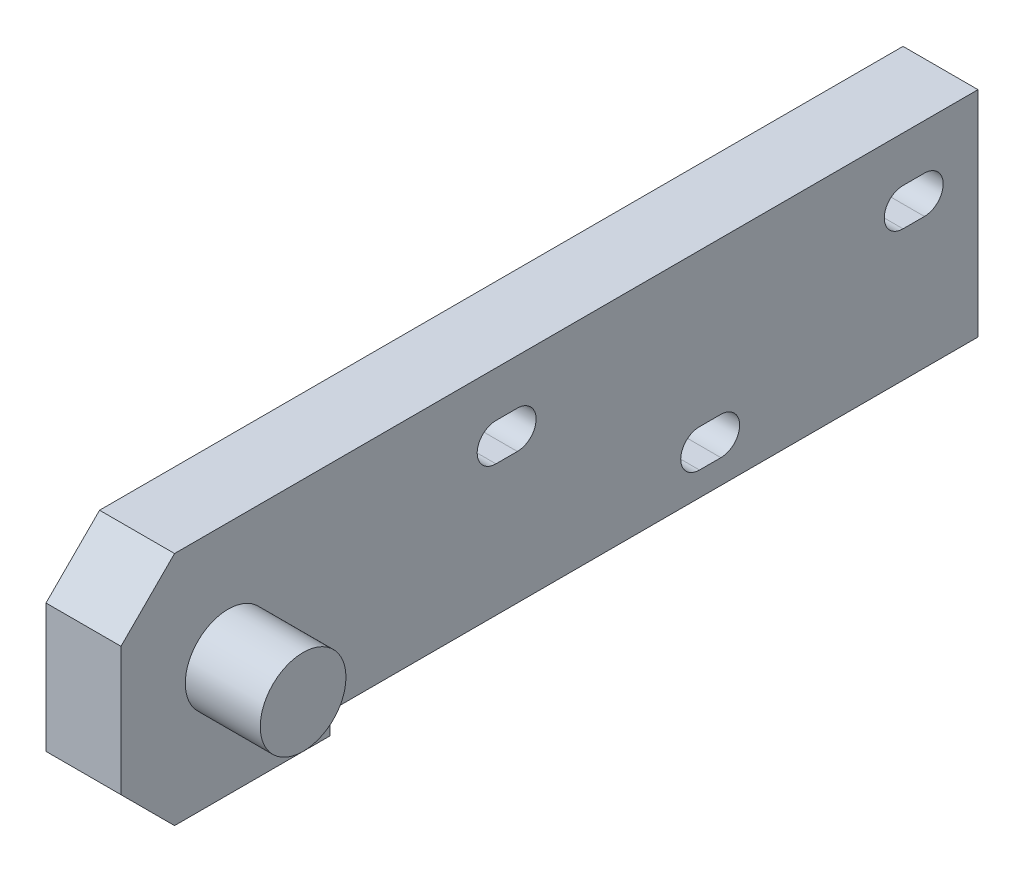
from build123d import *

# Parameters (mm, degrees)
SKETCH1_R           = 4
BOSS_EXTRUDE1_DEPTH = 7
BOSS_EXTRUDE2_START = 7
SKETCH1_4_R         = 4
BOSS_EXTRUDE2_DEPTH = 7


with BuildPart() as part:
    # Sketch1 → Boss-Extrude1 (new body)
    # profile 1 of 2: a face of its own
    with BuildSketch(Plane(origin=(0, 0, 0), x_dir=(0, 0, -1), z_dir=(1, 0, 0))):
        Polygon((-10, 6), (-10, -6), (-5, -11), (9.5, -11), (9.5, -9), (70, -9), (70, 11), (-5, 11), align=None)
        Circle(SKETCH1_R, mode=Mode.SUBTRACT)
        with BuildLine():
            ThreePointArc((63, 6.75), (61.25, 5), (63, 3.25))
            Line((63, 3.25), (65, 3.25))
            ThreePointArc((65, 3.25), (66.75, 5), (65, 6.75))
            Line((65, 6.75), (63, 6.75))
        make_face(mode=Mode.SUBTRACT)
        with BuildLine():
            ThreePointArc((46, -6.75), (47.75, -5), (46, -3.25))
            Line((46, -3.25), (44, -3.25))
            ThreePointArc((44, -3.25), (42.25, -5), (44, -6.75))
            Line((44, -6.75), (46, -6.75))
        make_face(mode=Mode.SUBTRACT)
        with BuildLine():
            ThreePointArc((27, 3.25), (28.75, 5), (27, 6.75))
            Line((27, 6.75), (25, 6.75))
            ThreePointArc((25, 6.75), (23.25, 5), (25, 3.25))
            Line((25, 3.25), (27, 3.25))
        make_face(mode=Mode.SUBTRACT)
    # profile 2 of 2: a face of its own
    with BuildSketch(Plane(origin=(0, 0, 0), x_dir=(0, 0, -1), z_dir=(1, 0, 0))):
        Circle(SKETCH1_R)
    extrude(amount=BOSS_EXTRUDE1_DEPTH)

    # Sketch1<4> → Boss-Extrude2 (add)
    with BuildSketch(Plane(origin=(0, 0, 0), x_dir=(0, 0, -1), z_dir=(1, 0, 0)).offset(BOSS_EXTRUDE2_START)):
        Circle(SKETCH1_4_R)
    extrude(amount=BOSS_EXTRUDE2_DEPTH)


solid = part.part
